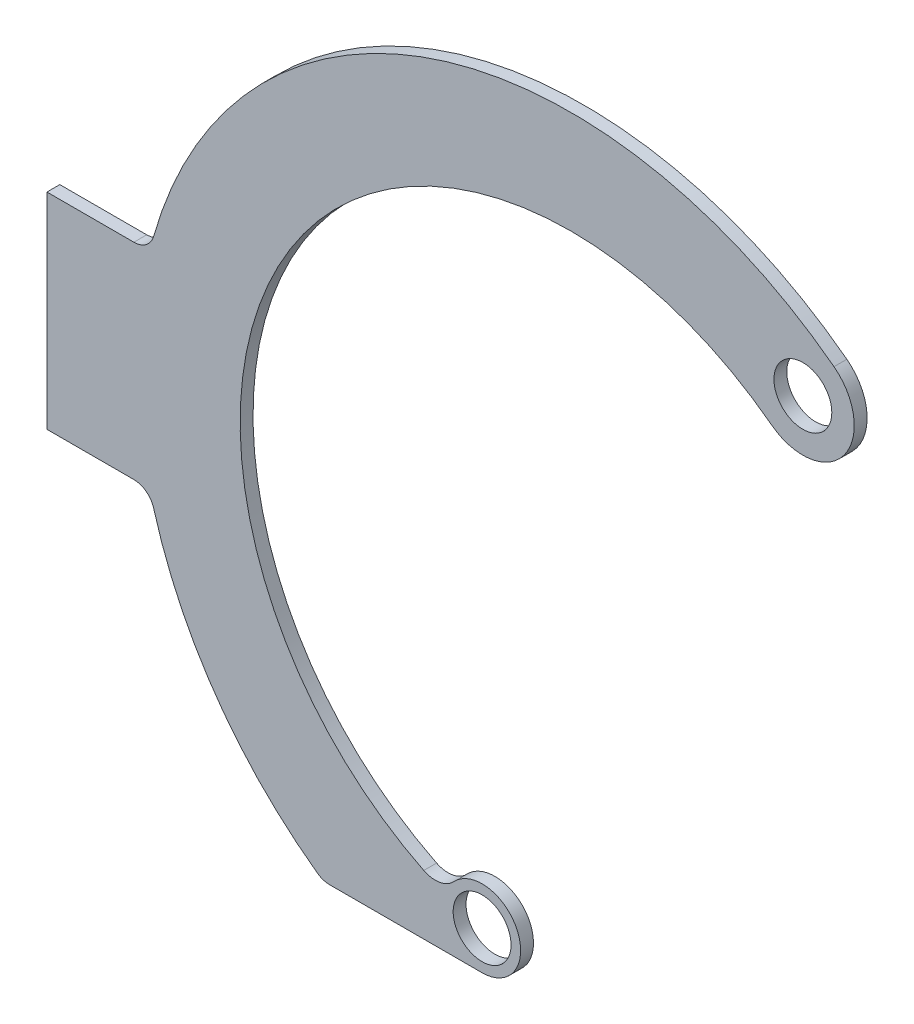
from build123d import *

# Parameters (mm, degrees)
SKETCH1_R           = 14.3002
BOSS_EXTRUDE1_DEPTH = 6.35
FILLET1_R           = 10.16
FILLET2_R           = 12.7


with BuildPart() as part:
    # Sketch1 → Boss-Extrude1 (new body)
    with BuildSketch(Plane.XY):
        with BuildLine():
            Line((-78.624201442, -19.05), (0, -19.05))
            ThreePointArc((0, -19.05), (15.29709191, 11.353478722), (-18.233617587, 5.517036315))
            ThreePointArc((-18.233617587, 5.517036315), (-97.907934324, 238.196201056), (143.154480855, 286.945585057))
            ThreePointArc((143.154480855, 286.945585057), (178.751803486, 291.757091583), (173.940297689, 327.354414313))
            ThreePointArc((173.940297689, 327.354414313), (-27.542038168, 358.917389173), (-164.282230707, 207.611497719))
            Line((-164.282230707, 207.611497719), (-215.082230707, 207.611497719))
            Line((-215.082230707, 207.611497719), (-215.082230707, 106.011497719))
            Line((-215.082230707, 106.011497719), (-164.282230707, 106.011497719))
            ThreePointArc((-164.282230707, 106.011497719), (-132.874579252, 35.657945846), (-78.624201442, -19.05))
        make_face()
        Circle(SKETCH1_R, mode=Mode.SUBTRACT)
        with Locations((158.547388858, 307.15)):
            Circle(SKETCH1_R, mode=Mode.SUBTRACT)
    extrude(amount=BOSS_EXTRUDE1_DEPTH)

    # Fillet1
    fillet1_edges = [part.edges().sort_by_distance(p)[0] for p in [
        (-78.624201442, -19.05, 3.175),
        (-164.282230707, 106.011497719, 3.175),
        (-164.282230707, 207.611497719, 3.175),
    ]]
    fillet(fillet1_edges, radius=FILLET1_R)

    # Fillet2
    fillet2_edges = [part.edges().sort_by_distance(p)[0] for p in [
        (-18.233617587, 5.517036315, 3.175),
    ]]
    fillet(fillet2_edges, radius=FILLET2_R)


solid = part.part
